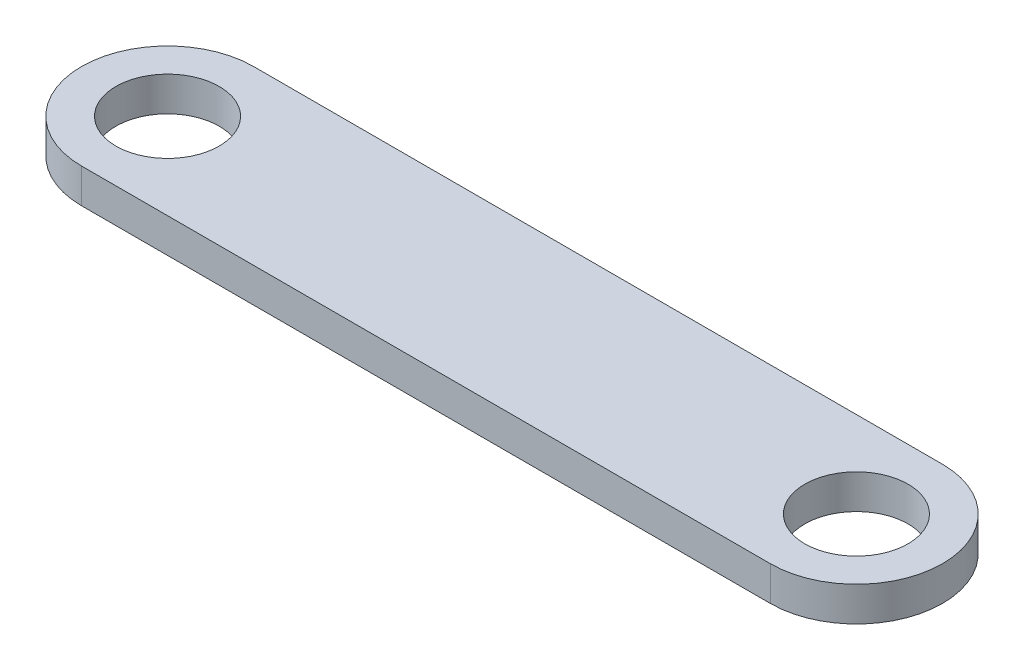
from build123d import *

# Parameters (mm, degrees)
SKETCH1_R           = 6
BOSS_EXTRUDE1_DEPTH = 4


with BuildPart() as part:
    # Sketch1 → Boss-Extrude1 (new body)
    with BuildSketch(Plane(origin=(0, 0, 0), x_dir=(1, 0, 0), z_dir=(0, 1, 0))):
        with BuildLine():
            Line((0, 10), (80, 10))
            ThreePointArc((80, 10), (90, 0), (80, -10))
            Line((80, -10), (0, -10))
            ThreePointArc((0, -10), (-10, 0), (0, 10))
        make_face()
        with Locations(Location((0, 0, 0), (0, 0, 270))):
            Circle(SKETCH1_R, mode=Mode.SUBTRACT)
        with Locations(Location((80, 0, 0), (0, 0, 270))):
            Circle(SKETCH1_R, mode=Mode.SUBTRACT)
    extrude(amount=BOSS_EXTRUDE1_DEPTH)


solid = part.part
